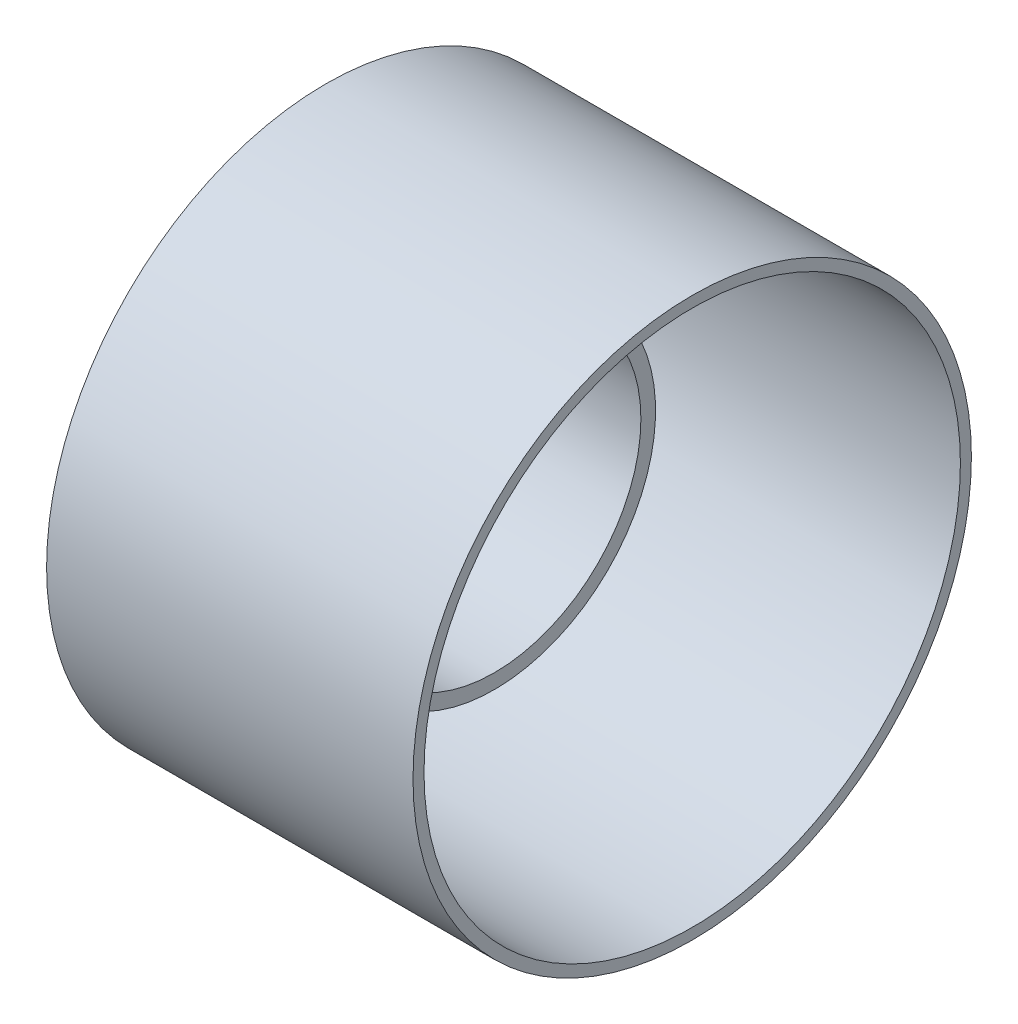
from build123d import *


with BuildPart() as part:
    # Sketch2 → Revolve1 (revolve)
    with BuildSketch(Plane.XY, mode=Mode.PRIVATE) as revolve1_sk:
        with BuildLine():
            Line((7.900124766, 45.904993762), (46, 44))
            Line((46, 44), (46, 40))
            Line((46, 40), (8, 40))
            ThreePointArc((8, 40), (6.585786438, 39.414213562), (6, 38))
            Line((6, 38), (6, 2))
            Line((6, 2), (0, 2))
            Line((0, 2), (0, 76.2))
            Line((0, 76.2), (6.299212598, 76.2))
            Line((6.299212598, 76.2), (100, 76.2))
            Line((100, 76.2), (100, 73.2))
            Line((100, 73.2), (8, 73.2))
            ThreePointArc((8, 73.2), (6.585786438, 72.614213562), (6, 71.2))
            Line((6, 71.2), (6, 47.902498439))
            ThreePointArc((6, 47.902498439), (6.550905374, 46.524048308), (7.900124766, 45.904993762))
        make_face()
    revolve(revolve1_sk.sketch.rotate(Axis((0, 0, 0), (1, 0, 0)), 90), axis=Axis((0, 0, 0), (1, 0, 0)))


solid = part.part
